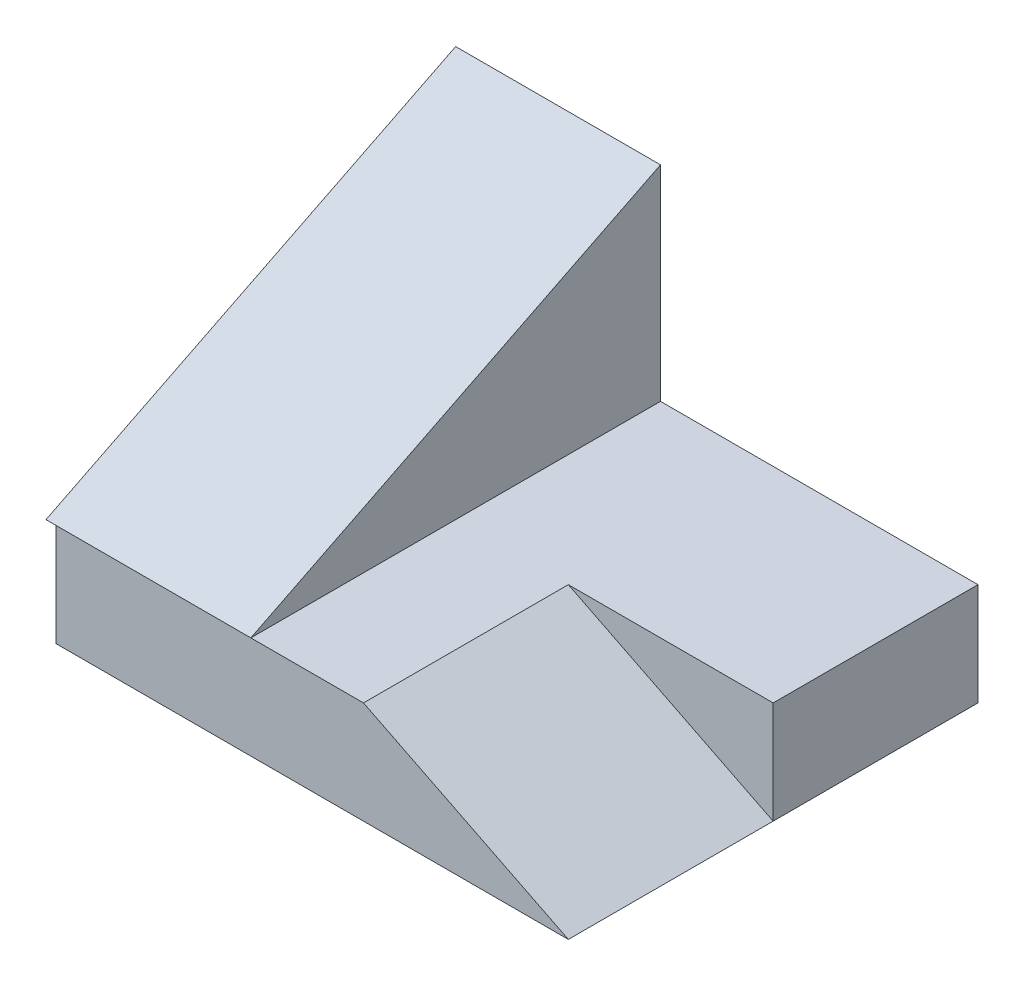
from build123d import *

# Parameters (mm, degrees)
SKETCH2_W           = 127
SKETCH2_H           = 101.6
BOSS_EXTRUDE1_DEPTH = 25.4
CUT_EXTRUDE2_DEPTH  = 50.8
BOSS_EXTRUDE2_DEPTH = 50.8


with BuildPart() as part:
    # Sketch2 → Boss-Extrude1 (new body)
    with BuildSketch(Plane(origin=(0, 0, 0), x_dir=(1, 0, 0), z_dir=(0, 1, 0))):
        with Locations((63.5, 50.8)):
            Rectangle(SKETCH2_W, SKETCH2_H)
    extrude(amount=BOSS_EXTRUDE1_DEPTH)

    # Sketch4 → Cut-Extrude2 (cut)
    with BuildSketch(Plane.XY):
        Polygon((76.2, 25.4), (127, 25.4), (127, 0), align=None)
    extrude(amount=-CUT_EXTRUDE2_DEPTH, mode=Mode.SUBTRACT)

    # Sketch5 → Boss-Extrude2 (add)
    with BuildSketch(Plane.ZY.offset(2.54)):
        Polygon((-101.6, 25.4), (0, 25.4), (-101.6, 76.2), align=None)
    extrude(amount=-BOSS_EXTRUDE2_DEPTH)


solid = part.part
